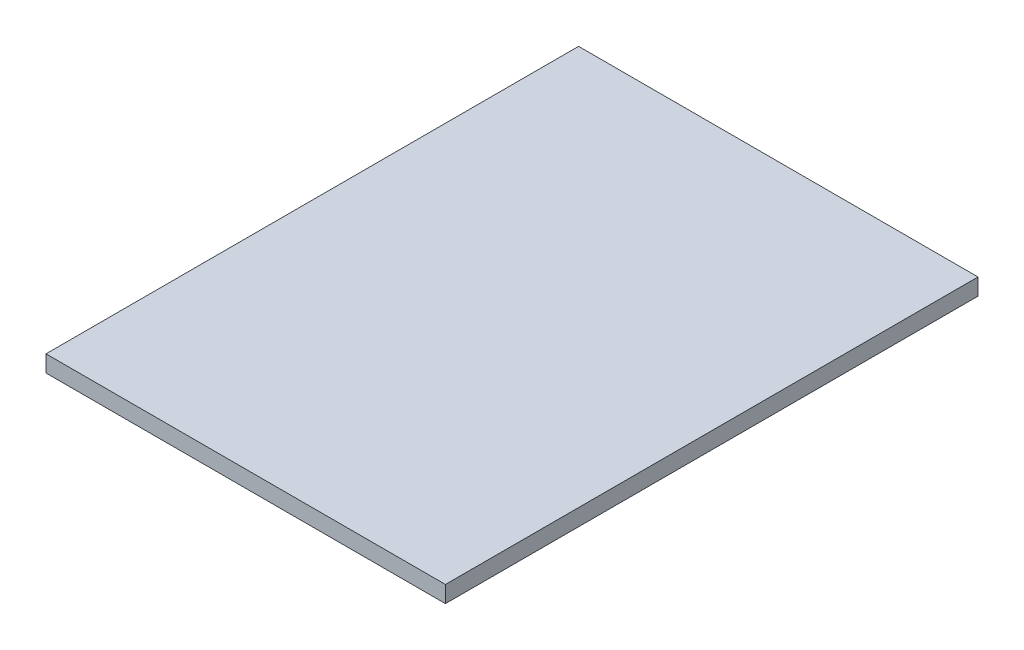
from build123d import *

# Parameters (mm, degrees)
SKETCH1_W           = 228.6
SKETCH1_H           = 304.8
BOSS_EXTRUDE1_DEPTH = 9.525


with BuildPart() as part:
    # Sketch1 → Boss-Extrude1 (new body)
    with BuildSketch(Plane(origin=(0, 0, 0), x_dir=(1, 0, 0), z_dir=(0, 1, 0))):
        Rectangle(SKETCH1_W, SKETCH1_H)
    extrude(amount=BOSS_EXTRUDE1_DEPTH)


solid = part.part
